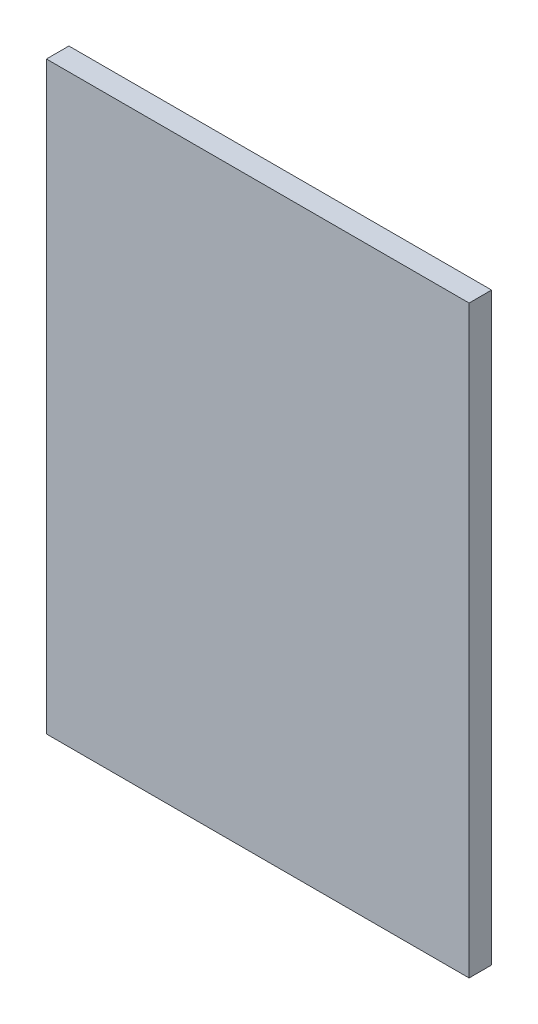
from build123d import *

# Parameters (mm, degrees)
SKETCH4_W           = 94
SKETCH4_H           = 130
BOSS_EXTRUDE2_DEPTH = 5


with BuildPart() as part:
    # Sketch4 → Boss-Extrude2 (new body)
    with BuildSketch(Plane(origin=(-106.485445015, -33.902005747, 5), x_dir=(-1, 0, 0), z_dir=(0, 0, 1))):
        with Locations((-48.255188942, -94.631770084)):
            Rectangle(SKETCH4_W, SKETCH4_H)
    extrude(amount=BOSS_EXTRUDE2_DEPTH)


solid = part.part
